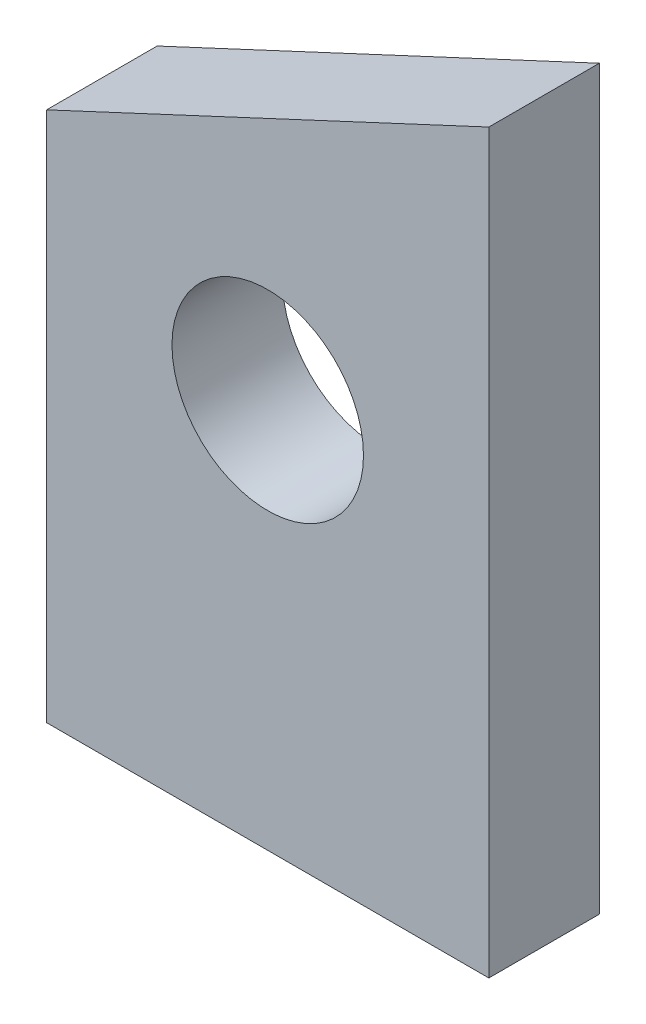
from build123d import *

# Parameters (mm, degrees)
SKETCH2_W           = 12.7
SKETCH2_H           = 3.175
BOSS_EXTRUDE1_DEPTH = 63.5
CUT_EXTRUDE1_REACH  = 66.835
SKETCH3_R           = 2.75


with BuildPart() as part:
    # Sketch2 → Boss-Extrude1 (new body)
    with BuildSketch(Plane(origin=(0, 0, 0), x_dir=(1, 0, 0), z_dir=(0, 1, 0))):
        with Locations((6.35, -1.5875)):
            Rectangle(SKETCH2_W, SKETCH2_H)
    extrude(amount=BOSS_EXTRUDE1_DEPTH)

    # Sketch3 → Cut-Extrude1 (cut, up to next)
    with BuildSketch(Plane(origin=(0, 0, 3.175), x_dir=(-1, 0, 0), z_dir=(0, 0, -1)), mode=Mode.PRIVATE) as cut_extrude1_sk1:
        with Locations(Location((-6.35, 11.197261172, 0), (0, 0, 180))):
            Circle(SKETCH3_R)
    cut_extrude1_tool1 = extrude(cut_extrude1_sk1.sketch, amount=CUT_EXTRUDE1_REACH, mode=Mode.PRIVATE) & part.part
    # Sketch3 → Cut-Extrude1 (cut, up to next)
    with BuildSketch(Plane(origin=(0, 0, 3.175), x_dir=(-1, 0, 0), z_dir=(0, 0, -1)), mode=Mode.PRIVATE) as cut_extrude1_sk2:
        Polygon((-12.7, 21.164764587), (0, 15.242657328), (0, 63.5), (-12.7, 63.5), align=None)
    cut_extrude1_tool2 = extrude(cut_extrude1_sk2.sketch, amount=CUT_EXTRUDE1_REACH, mode=Mode.PRIVATE) & part.part
    add(cut_extrude1_tool1.solids().sort_by_distance((6.35, 11.197261, 3.175))[0], mode=Mode.SUBTRACT)
    add(cut_extrude1_tool2.solids().sort_by_distance((6.211632, 40.819594, 3.175))[0], mode=Mode.SUBTRACT)


solid = part.part
